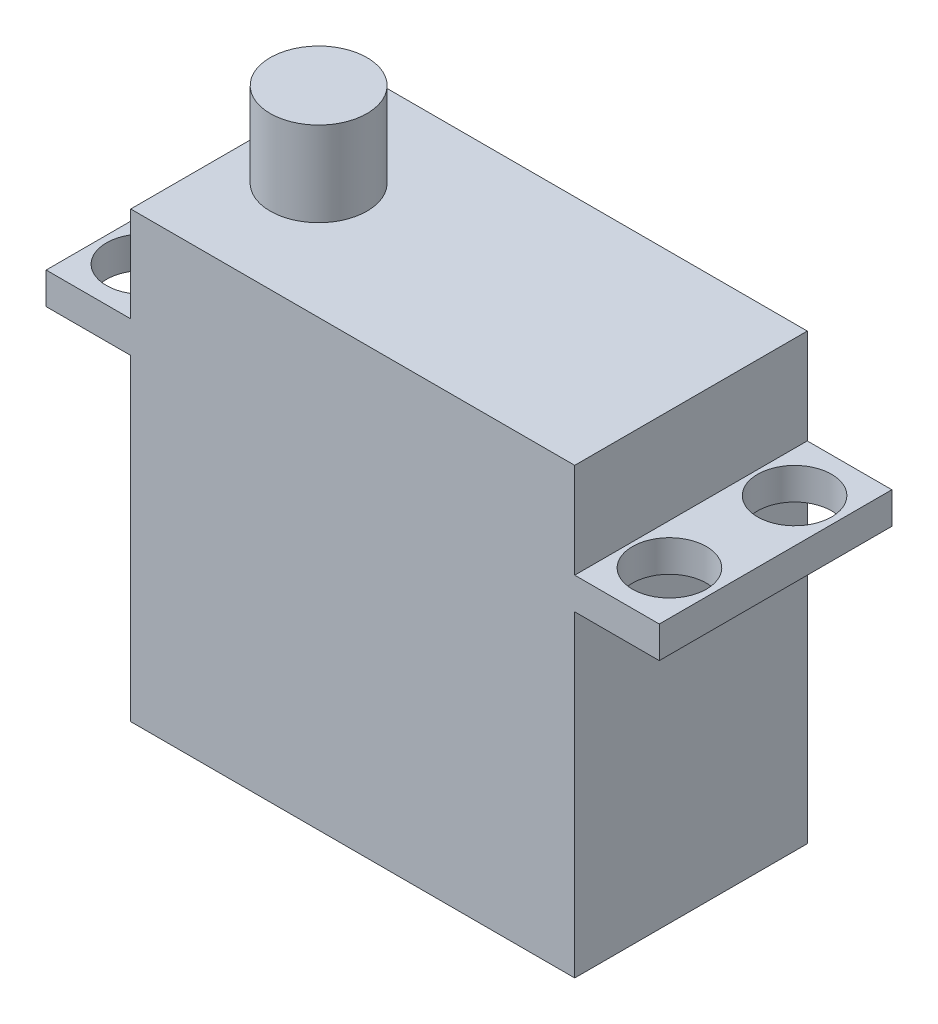
from build123d import *

# Parameters (mm, degrees)
SKETCH_1_W          = 42
SKETCH_1_H          = 22
EXTRUDE_1_DEPTH     = 42
SKETCH_2_W          = 8
SKETCH_2_H          = 22
EXTRUDE_2_DEPTH     = 3
SKETCH_3_R          = 3.5
CUT_EXTRUDE_1_DEPTH = 3
SKETCH_4_R          = 4.581673227
EXTRUDE_3_DEPTH     = 8


with BuildPart() as part:
    # 草图1 → 凸台-拉伸1 (new body)
    with BuildSketch(Plane(origin=(0, 0, 0), x_dir=(1, 0, 0), z_dir=(0, 1, 0))):
        Rectangle(SKETCH_1_W, SKETCH_1_H)
    extrude(amount=EXTRUDE_1_DEPTH)

    # 草图2 → 凸台-拉伸2 (add)
    with BuildSketch(Plane(origin=(0, 30, 0), x_dir=(1, 0, 0), z_dir=(0, 1, 0))):
        with Locations((-25, 0)):
            Rectangle(SKETCH_2_W, SKETCH_2_H)
        with Locations((25, 0)):
            Rectangle(SKETCH_2_W, SKETCH_2_H)
    extrude(amount=EXTRUDE_2_DEPTH)

    # 草图3 → 切除-拉伸1 (cut)
    with BuildSketch(Plane(origin=(0, 33, 0), x_dir=(1, 0, 0), z_dir=(0, 1, 0))):
        with Locations(Location((-24.879659127, -5.919206434, 0), (0, 0, 270))):
            Circle(SKETCH_3_R)
        with Locations(Location((-24.879659127, 5.919206434, 0), (0, 0, 270))):
            Circle(SKETCH_3_R)
        with Locations(Location((24.879659127, 5.919206434, 0), (0, 0, 270))):
            Circle(SKETCH_3_R)
        with Locations(Location((24.879659127, -5.919206434, 0), (0, 0, 270))):
            Circle(SKETCH_3_R)
    extrude(amount=-CUT_EXTRUDE_1_DEPTH, mode=Mode.SUBTRACT)

    # 草图4 → 凸台-拉伸3 (add)
    with BuildSketch(Plane(origin=(0, 42, 0), x_dir=(1, 0, 0), z_dir=(0, 1, 0))):
        with Locations(Location((-14.223956567, 0, 0), (0, 0, 270))):
            Circle(SKETCH_4_R)
    extrude(amount=EXTRUDE_3_DEPTH)


solid = part.part
